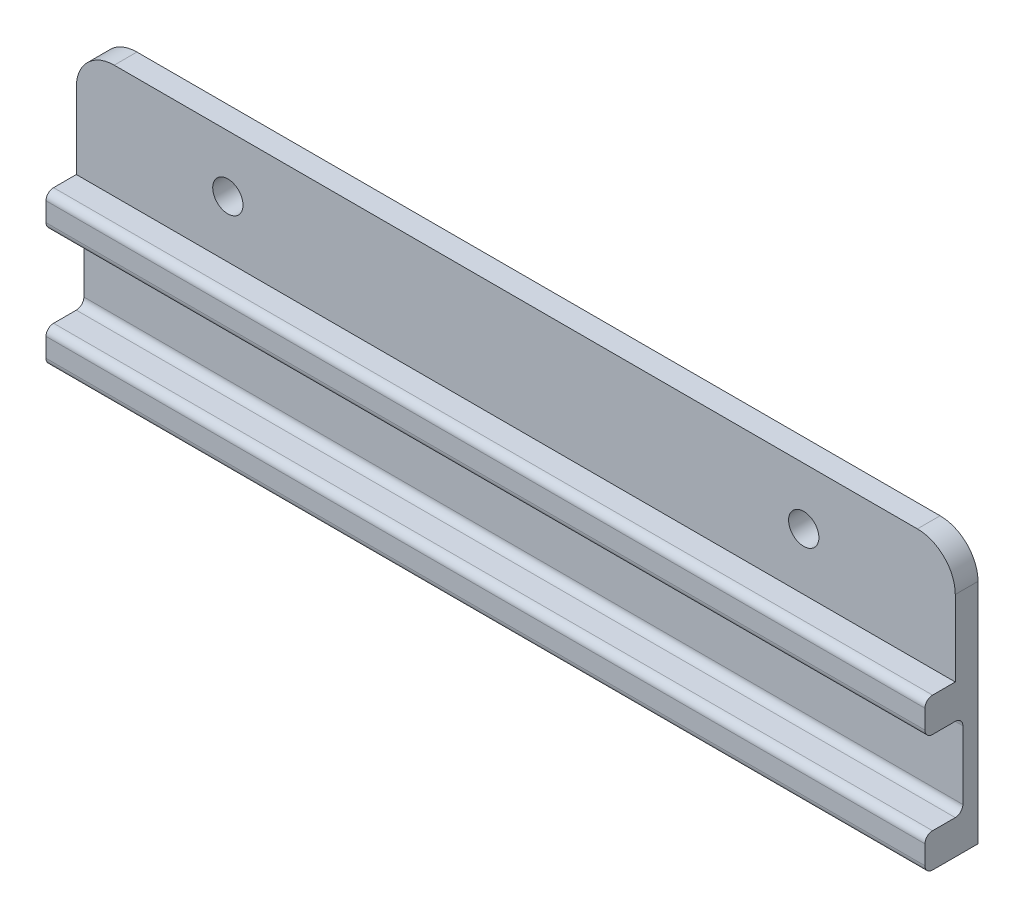
from build123d import *

# Parameters (mm, degrees)
SKETCH1_W           = 116
SKETCH1_H           = 20
BOSS_EXTRUDE1_DEPTH = 2
SKETCH2_W           = 116
SKETCH2_H           = 4.5
BOSS_EXTRUDE2_DEPTH = 5
FILLET1_R           = 1
SKETCH3_W           = 116
SKETCH3_H           = 3
BOSS_EXTRUDE3_DEPTH = 15
FILLET2_R           = 5
SKETCH4_R           = 2
CUT_EXTRUDE1_DEPTH  = 15


with BuildPart() as part:
    # Sketch1 → Boss-Extrude1 (new body)
    with BuildSketch(Plane.XY):
        with Locations((58, 10)):
            Rectangle(SKETCH1_W, SKETCH1_H)
    extrude(amount=BOSS_EXTRUDE1_DEPTH)

    # Sketch2 → Boss-Extrude2 (add)
    with BuildSketch(Plane.XY.offset(2)):
        with Locations((58, 17.75)):
            Rectangle(SKETCH2_W, SKETCH2_H)
        with Locations((58, 2.25)):
            Rectangle(SKETCH2_W, SKETCH2_H)
    extrude(amount=BOSS_EXTRUDE2_DEPTH)

    # Fillet1
    fillet1_edges = [part.edges().sort_by_distance(p)[0] for p in [
        (58, 15.5, 2),
        (58, 15.5, 7),
        (58, 20, 7),
        (58, 4.5, 2),
        (58, 0, 7),
        (58, 4.5, 7),
    ]]
    fillet(fillet1_edges, radius=FILLET1_R)

    # Sketch3 → Boss-Extrude3 (add)
    with BuildSketch(Plane(origin=(0, 20, 0), x_dir=(1, 0, 0), z_dir=(0, 1, 0))):
        with Locations((58, -1.5)):
            Rectangle(SKETCH3_W, SKETCH3_H)
    extrude(amount=BOSS_EXTRUDE3_DEPTH)

    # Fillet2
    fillet2_edges = [part.edges().sort_by_distance(p)[0] for p in [
        (0, 35, 1.5),
        (116, 35, 1.5),
    ]]
    fillet(fillet2_edges, radius=FILLET2_R)

    # Sketch4 → Cut-Extrude1 (cut)
    with BuildSketch(Plane.XY.offset(3)):
        with Locations((96, 27.5)):
            Circle(SKETCH4_R)
        with Locations(Location((20, 27.5, 0), (0, 0, 180))):
            Circle(SKETCH4_R)
    extrude(amount=-CUT_EXTRUDE1_DEPTH, mode=Mode.SUBTRACT)


solid = part.part
